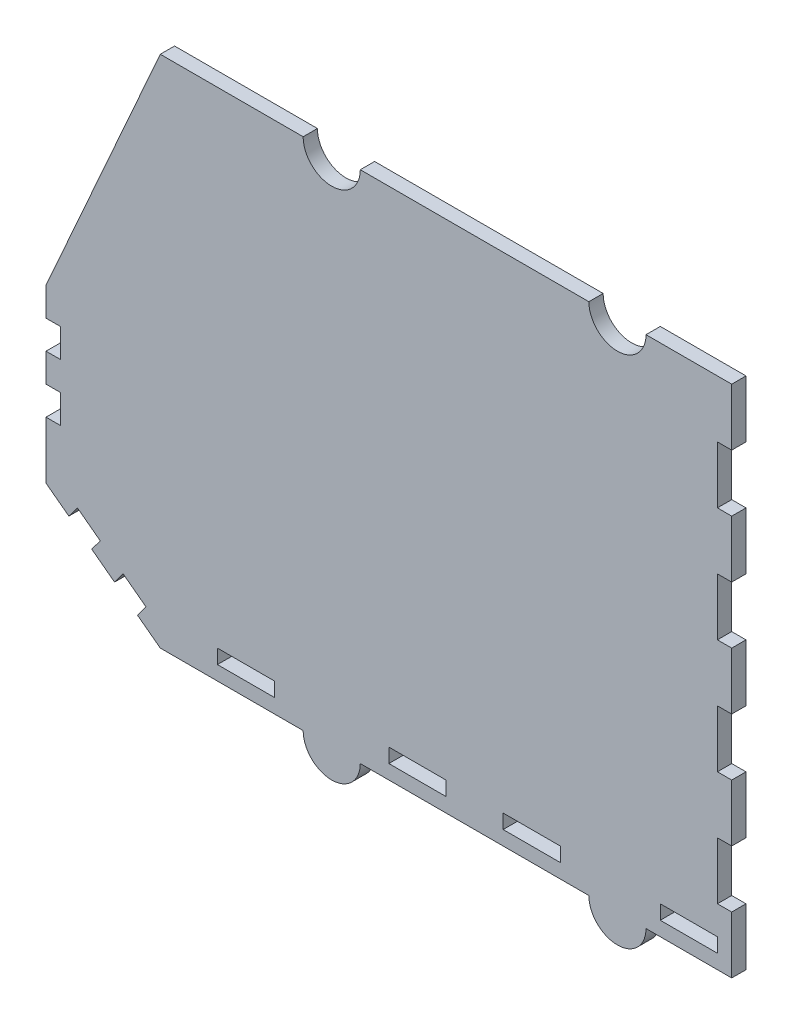
from build123d import *

# Parameters (mm, degrees)
SKETCH1_W           = 10
SKETCH1_H           = 2.5
BOSS_EXTRUDE1_DEPTH = 2.5


with BuildPart() as part:
    # Sketch1 → Boss-Extrude1 (new body)
    with BuildSketch(Plane.XY):
        with BuildLine():
            Line((20, 0), (45, 0))
            ThreePointArc((45, 0), (50, -5), (55, 0))
            Line((55, 0), (95, 0))
            ThreePointArc((95, 0), (100, -5), (105, 0))
            Line((105, 0), (120, 0))
            Line((120, 0), (120, 10))
            Line((120, 10), (117.5, 10))
            Line((117.5, 10), (117.5, 20))
            Line((117.5, 20), (120, 20))
            Line((120, 20), (120, 30))
            Line((120, 30), (117.5, 30))
            Line((117.5, 30), (117.5, 40))
            Line((117.5, 40), (120, 40))
            Line((120, 40), (120, 50))
            Line((120, 50), (117.5, 50))
            Line((117.5, 50), (117.5, 60))
            Line((117.5, 60), (120, 60))
            Line((120, 60), (120, 70))
            Line((120, 70), (117.5, 70))
            Line((117.5, 70), (117.5, 80))
            Line((117.5, 80), (120, 80))
            Line((120, 80), (120, 90))
            Line((120, 90), (105, 90))
            ThreePointArc((105, 90), (100, 85), (95, 90))
            Line((95, 90), (55, 90))
            ThreePointArc((55, 90), (50, 85), (45, 90))
            Line((45, 90), (20, 90))
            Line((20, 90), (0, 45))
            Line((0, 45), (0, 40))
            Line((0, 40), (2.5, 40))
            Line((2.5, 40), (2.5, 35))
            Line((2.5, 35), (0, 35))
            Line((0, 35), (0, 30))
            Line((0, 30), (2.5, 30))
            Line((2.5, 30), (2.5, 25))
            Line((2.5, 25), (0, 25))
            Line((0, 25), (0, 15))
            Line((0, 15), (4, 12))
            Line((4, 12), (5.5, 14))
            Line((5.5, 14), (9.5, 11))
            Line((9.5, 11), (8, 9))
            Line((8, 9), (12, 6))
            Line((12, 6), (13.5, 8))
            Line((13.5, 8), (17.5, 5))
            Line((17.5, 5), (16, 3))
            Line((16, 3), (20, 0))
        make_face()
        with Locations((112.5, 3.75)):
            Rectangle(SKETCH1_W, SKETCH1_H, mode=Mode.SUBTRACT)
        with Locations((85, 3.75)):
            Rectangle(SKETCH1_W, SKETCH1_H, mode=Mode.SUBTRACT)
        with Locations((65, 3.75)):
            Rectangle(SKETCH1_W, SKETCH1_H, mode=Mode.SUBTRACT)
        with Locations((35, 3.75)):
            Rectangle(SKETCH1_W, SKETCH1_H, mode=Mode.SUBTRACT)
    extrude(amount=BOSS_EXTRUDE1_DEPTH)


solid = part.part
